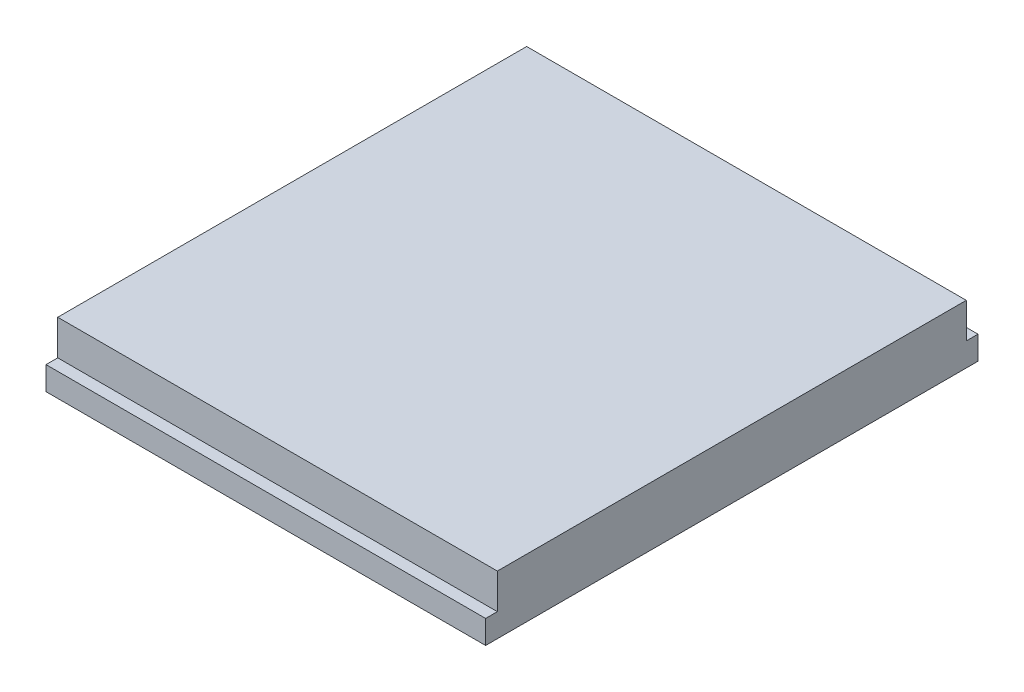
from build123d import *

# Parameters (mm, degrees)
SKETCH1_W           = 37.5
SKETCH1_H           = 42
BOSS_EXTRUDE1_DEPTH = 5
SKETCH2_W           = 37.5
SKETCH2_H           = 1
CUT_EXTRUDE1_DEPTH  = 3
SKETCH3_W           = 37.5
SKETCH3_H           = 1
CUT_EXTRUDE2_DEPTH  = 3


with BuildPart() as part:
    # Sketch1 → Boss-Extrude1 (new body)
    with BuildSketch(Plane(origin=(0, 0, 0), x_dir=(1, 0, 0), z_dir=(0, 1, 0))):
        Rectangle(SKETCH1_W, SKETCH1_H)
    extrude(amount=BOSS_EXTRUDE1_DEPTH)

    # Sketch2 → Cut-Extrude1 (cut)
    with BuildSketch(Plane(origin=(0, 5, 0), x_dir=(1, 0, 0), z_dir=(0, 1, 0))):
        with Locations((0, -20.5)):
            Rectangle(SKETCH2_W, SKETCH2_H)
    extrude(amount=-CUT_EXTRUDE1_DEPTH, mode=Mode.SUBTRACT)

    # Sketch3 → Cut-Extrude2 (cut)
    with BuildSketch(Plane(origin=(0, 5, 0), x_dir=(1, 0, 0), z_dir=(0, 1, 0))):
        with Locations((0, 20.5)):
            Rectangle(SKETCH3_W, SKETCH3_H)
    extrude(amount=-CUT_EXTRUDE2_DEPTH, mode=Mode.SUBTRACT)


solid = part.part
